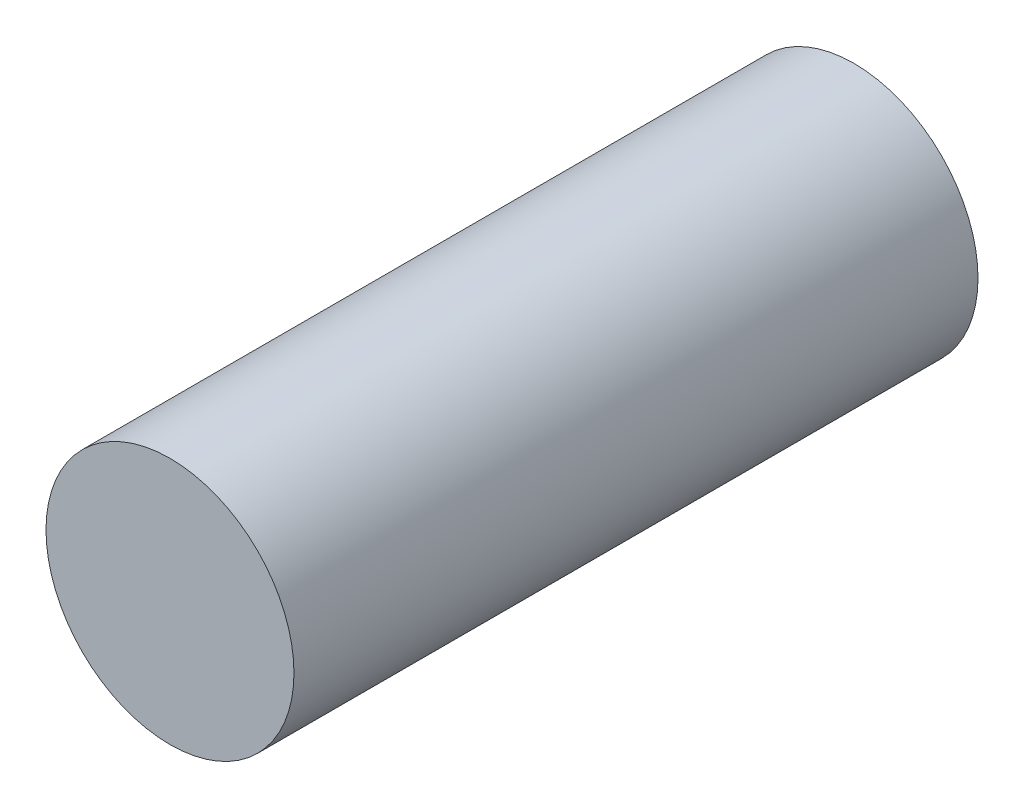
from build123d import *

# Parameters (mm, degrees)
SKETCH1_R           = 1.45
BOSS_EXTRUDE1_DEPTH = 8


with BuildPart() as part:
    # Sketch1 → Boss-Extrude1 (new body)
    with BuildSketch(Plane.XY):
        Circle(SKETCH1_R)
    extrude(amount=BOSS_EXTRUDE1_DEPTH)


solid = part.part
